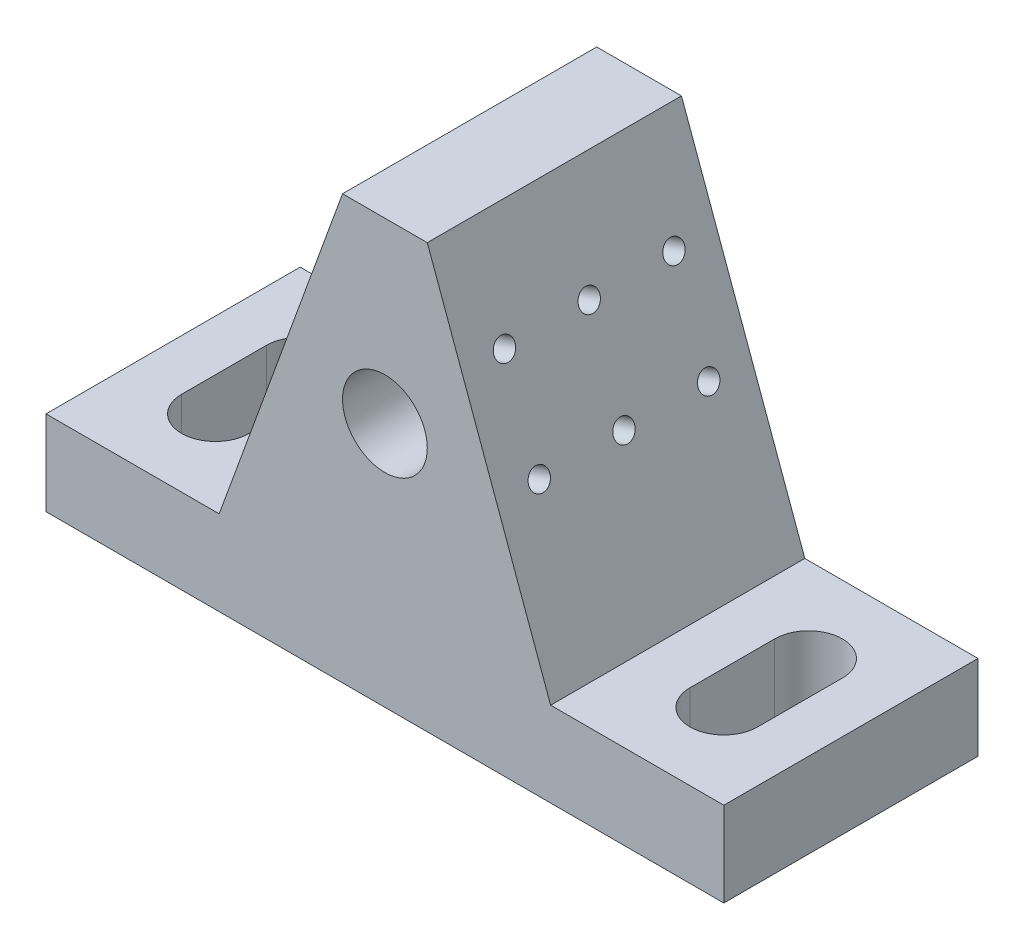
from build123d import *

# Parameters (mm, degrees)
BOSS_EXTRUDE_DEPTH   = 15
SLOT_CUT_DEPTH       = 59.523499554
SKETCH3_R            = 5
GUIDE_HOLE_DEPTH     = 71.710678119
LPATTERN2_COUNT      = 3
LPATTERN2_PITCH      = 10
LPATTERN2_COUNT_DIR2 = 2
LPATTERN2_PITCH_DIR2 = 12


with BuildPart() as part:
    # Sketch1 → Boss Extrude (new, symmetric)
    with BuildSketch(Plane.XY):
        Polygon((-40, 0), (40, 0), (40, 10), (19.558809371, 10), (5, 50), (-5, 50), (-19.558809371, 10), (-40, 10), align=None)
    extrude(amount=BOSS_EXTRUDE_DEPTH, both=True)

    # Sketch2 → Slot Cut (cut, through all)
    with BuildSketch(Plane(origin=(0, 10, 0), x_dir=(1, 0, 0), z_dir=(0, 1, 0))):
        with BuildLine():
            Line((26, -5), (26, 5))
            ThreePointArc((26, 5), (30, 9), (34, 5))
            Line((34, 5), (34, -5))
            ThreePointArc((34, -5), (30, -9), (26, -5))
        make_face()
    slot_cut = extrude(amount=-SLOT_CUT_DEPTH, mode=Mode.SUBTRACT)

    # Mirror4: Slot Cut across plane
    add(slot_cut.mirror(Plane(origin=(0, 0, 0), x_dir=(0, 0, 1), z_dir=(1, 0, 0))), mode=Mode.SUBTRACT)

    # Sketch3 → Guide Hole (cut, through all)
    with BuildSketch(Plane.XY.offset(15)):
        with Locations((0, 29)):
            Circle(SKETCH3_R)
    extrude(amount=-GUIDE_HOLE_DEPTH, mode=Mode.SUBTRACT)

    # Sketch17 → M3x0.5 Tapped Hole5 (revolve, cut)
    with BuildSketch(Plane(origin=(13.216501869, 27.425346647, 10), x_dir=(-0.3420201433256729, 0.9396926207859069, 0), z_dir=(0, 0, 1))):
        Polygon((0, 0), (0, 8.251075774), (1.25, 7.5), (1.25, 0), align=None)
    m3x0_5_tapped_hole5 = revolve(axis=Axis((19.183550011, 29.597174557, 10), (-0.9396926207859069, -0.3420201433256729, 0)), mode=Mode.SUBTRACT)

    # LPattern2: M3x0.5 Tapped Hole5 3 × 2
    with Locations(*[Vector(0, 0, -1) * (i * LPATTERN2_PITCH) + Vector(-0.34202014332567304, 0.9396926207859069, 0) * (j * LPATTERN2_PITCH_DIR2) for i in range(LPATTERN2_COUNT) for j in range(LPATTERN2_COUNT_DIR2) if (i, j) != (0, 0)]):
        add(m3x0_5_tapped_hole5, mode=Mode.SUBTRACT)


solid = part.part
